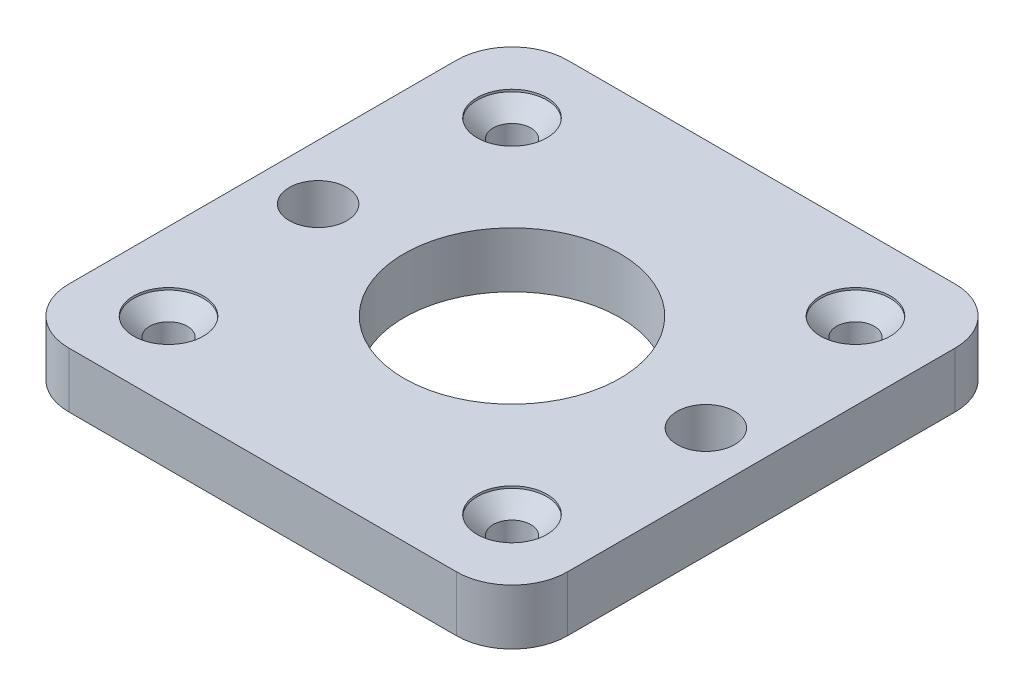
from build123d import *

# Parameters (mm, degrees)
ESBO_O1_W                                    = 45
ESBO_O1_H                                    = 45
ESBO_O1_R                                    = 9.75
RESSALTO_EXTRUS_O1_DEPTH                     = 2.5
ESCAREADO_PARA_PARAFUSO_COM_CABE_A_E_2_COUNT = 2
ESCAREADO_PARA_PARAFUSO_COM_CABE_A_E_2_PITCH = 31
ESCAREADO_PARA_PARAFUSO_COM_CABE_A_E_3_COUNT = 2
ESCAREADO_PARA_PARAFUSO_COM_CABE_A_E_3_PITCH = 43.840620434
ESCAREADO_PARA_PARAFUSO_COM_CABE_A_E_4_COUNT = 2
ESCAREADO_PARA_PARAFUSO_COM_CABE_A_E_4_PITCH = 31
FILETE1_R                                    = 5


with BuildPart() as part:
    # Esboço1 → Ressalto-extrusão1 (new, symmetric)
    with BuildSketch(Plane(origin=(0, 0, 0), x_dir=(1, 0, 0), z_dir=(0, 1, 0))):
        Rectangle(ESBO_O1_W, ESBO_O1_H)
        with Locations(Location((0, 0, 0), (0, 0, 270))):
            Circle(ESBO_O1_R, mode=Mode.SUBTRACT)
    extrude(amount=RESSALTO_EXTRUS_O1_DEPTH, both=True)

    # Esboço4 → Escareado para parafuso com cabeça escareada elevada de M31 (revolve, cut)
    with BuildSketch(Plane(origin=(-15.5, 2.5, -15.5), x_dir=(0, 0, 1), z_dir=(1, 0, 0))):
        Polygon((0, 0), (0, 5), (1.725, 5), (1.7, 4.975), (1.7, 1.65), (3.15, 0.2), (3.15, 0), align=None)
    escareado_para_parafuso_com_cabe_a_escar = revolve(axis=Axis((-15.5, 8.85, -15.5), (0, -1, 0)), mode=Mode.SUBTRACT)

    # Escareado para parafuso com cabe_a e 2: Escareado para parafuso com cabeça escareada elevada de M31 ×2
    with Locations(*[(i * ESCAREADO_PARA_PARAFUSO_COM_CABE_A_E_2_PITCH, 0, 0) for i in range(1, ESCAREADO_PARA_PARAFUSO_COM_CABE_A_E_2_COUNT)]):
        add(escareado_para_parafuso_com_cabe_a_escar, mode=Mode.SUBTRACT)

    # Escareado para parafuso com cabe_a e 3: Escareado para parafuso com cabeça escareada elevada de M31 ×2
    with Locations(*[Vector(0.7071067811865447, 0, 0.7071067811865503) * (i * ESCAREADO_PARA_PARAFUSO_COM_CABE_A_E_3_PITCH) for i in range(1, ESCAREADO_PARA_PARAFUSO_COM_CABE_A_E_3_COUNT)]):
        add(escareado_para_parafuso_com_cabe_a_escar, mode=Mode.SUBTRACT)

    # Escareado para parafuso com cabe_a e 4: Escareado para parafuso com cabeça escareada elevada de M31 ×2
    with Locations(*[(0, 0, i * ESCAREADO_PARA_PARAFUSO_COM_CABE_A_E_4_PITCH) for i in range(1, ESCAREADO_PARA_PARAFUSO_COM_CABE_A_E_4_COUNT)]):
        add(escareado_para_parafuso_com_cabe_a_escar, mode=Mode.SUBTRACT)

    # Filete1
    filete1_edges = [part.edges().sort_by_distance(p)[0] for p in [
        (22.5, 0, 22.5),
        (-22.5, 0, 22.5),
        (-22.5, 0, -22.5),
        (22.5, 0, -22.5),
    ]]
    fillet(filete1_edges, radius=FILETE1_R)

    # Esboço5 → Furo de diâmetro Ø5.2 (5.2)1 (revolve, cut)
    with BuildSketch(Plane(origin=(17.5, -2.5, 0), x_dir=(0, 0, -1), z_dir=(1, 0, 0))):
        Polygon((0, 0), (0, 47.562237609), (2.6, 46), (2.6, 0), align=None)
    furo_de_di_metro_5_2_5_2_1 = revolve(axis=Axis((17.5, -8.85, 0), (0, 1, 0)), mode=Mode.SUBTRACT)

    # Espelhar1: Furo de diâmetro Ø5.2 (5.2)1 across plane
    add(furo_de_di_metro_5_2_5_2_1.mirror(Plane(origin=(0, 0, 0), x_dir=(0, 0, 1), z_dir=(1, 0, 0))), mode=Mode.SUBTRACT)


solid = part.part
